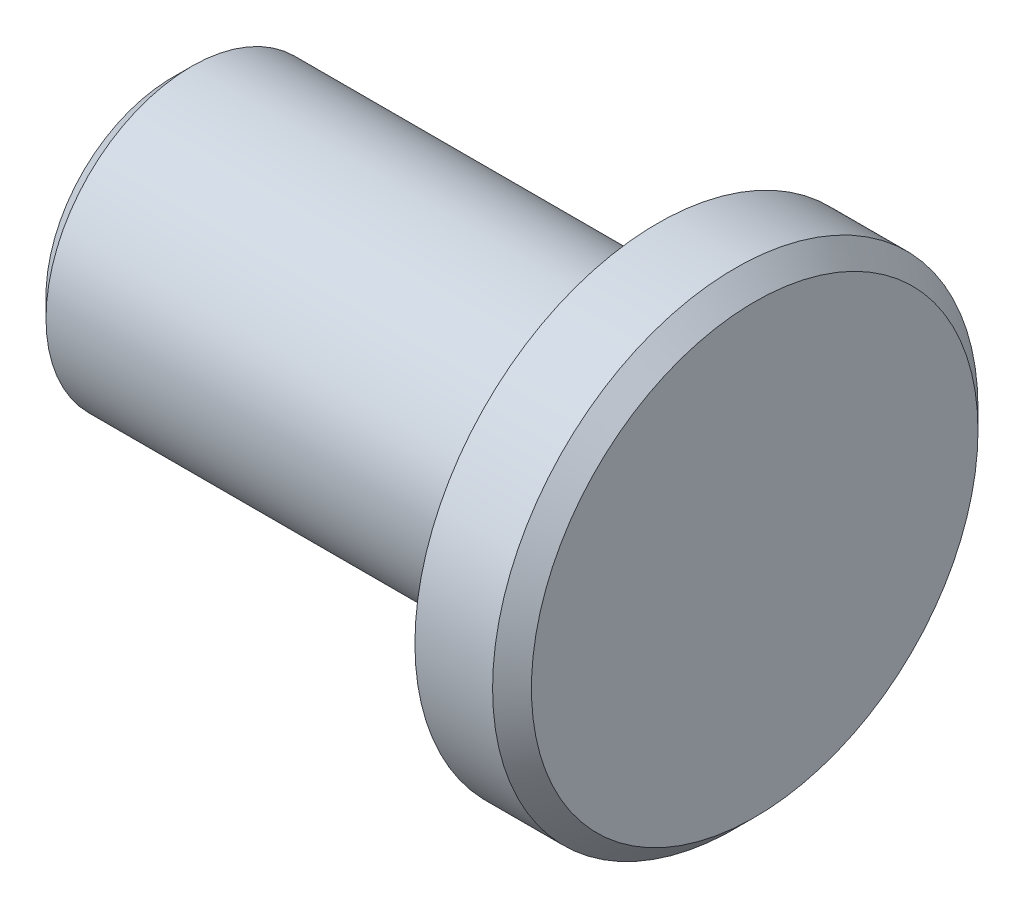
from build123d import *

# Parameters (mm, degrees)
SKETCH1_R           = 1.5
BOSS_EXTRUDE1_DEPTH = 5
SKETCH2_R           = 2.5
BOSS_EXTRUDE2_DEPTH = 1
CHAMFER1_SIZE       = 0.2


with BuildPart() as part:
    # Sketch1 → Boss-Extrude1 (new body)
    with BuildSketch(Plane(origin=(0, 0, 0), x_dir=(0, 0, -1), z_dir=(1, 0, 0))):
        Circle(SKETCH1_R)
    extrude(amount=BOSS_EXTRUDE1_DEPTH)

    # Sketch2 → Boss-Extrude2 (add)
    with BuildSketch(Plane(origin=(5, 0, 0), x_dir=(0, 0, -1), z_dir=(1, 0, 0))):
        Circle(SKETCH2_R)
    extrude(amount=BOSS_EXTRUDE2_DEPTH)

    # Chamfer1
    chamfer1_edges = [part.edges().sort_by_distance(p)[0] for p in [
        (0, 0, 1.5),
        (6, 0, 2.5),
    ]]
    chamfer(chamfer1_edges, length=CHAMFER1_SIZE)


solid = part.part
